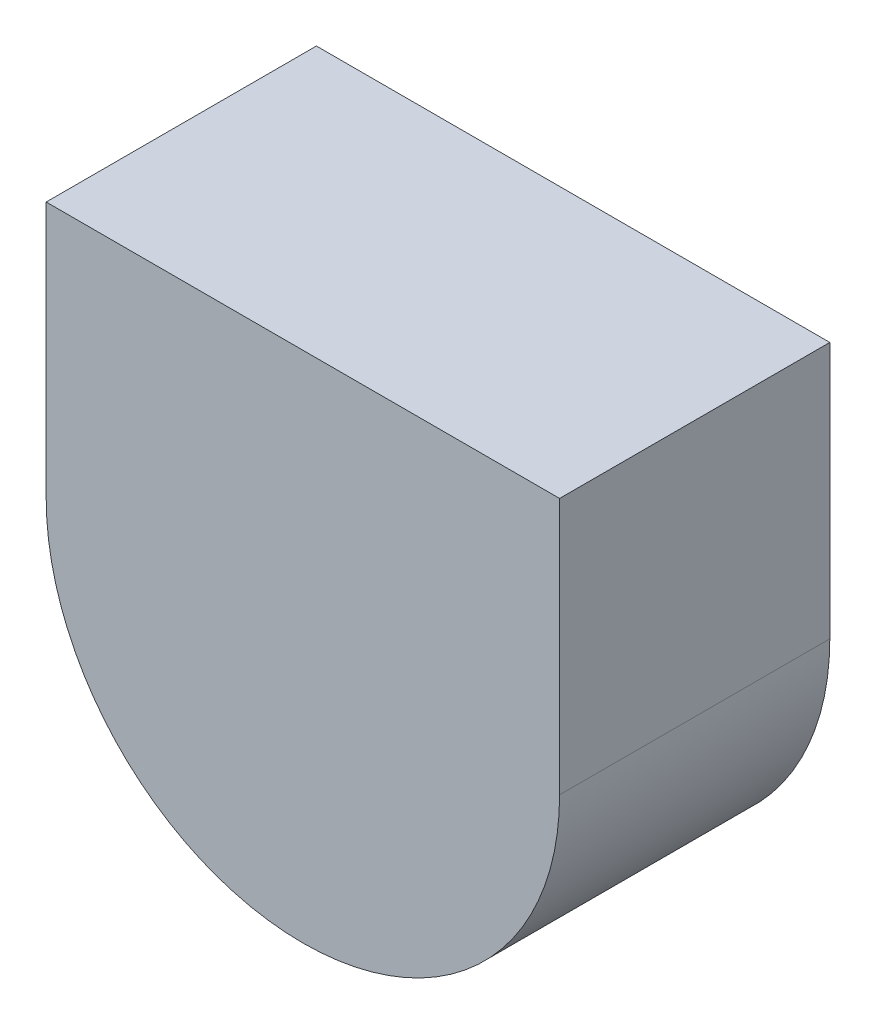
from build123d import *

# Parameters (mm, degrees)
BOSS_EXTRUDE1_DEPTH = 20


with BuildPart() as part:
    # Sketch1 → Boss-Extrude1 (new body)
    with BuildSketch(Plane.XY):
        with BuildLine():
            Line((-19, 0), (-19, 19))
            Line((-19, 19), (19, 19))
            Line((19, 19), (19, 0))
            ThreePointArc((19, 0), (0, -19), (-19, 0))
        make_face()
    extrude(amount=BOSS_EXTRUDE1_DEPTH)


solid = part.part
